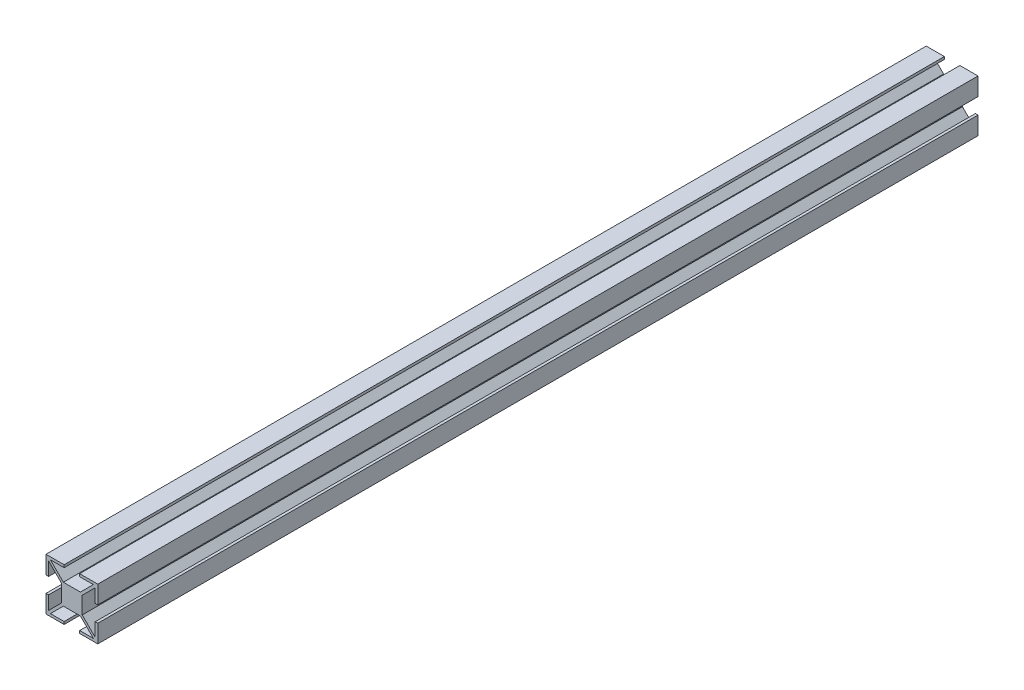
from build123d import *

# Parameters (mm, degrees)
BOSS_EXTRUDE1_DEPTH = 340


with BuildPart() as part:
    # Sketch2 → Boss-Extrude1 (new body)
    with BuildSketch(Plane.XY):
        Polygon((-10, 10), (-3, 10), (-3, 9), (-8.292893219, 9), (-3.292893219, 4), (3.292893219, 4), (8.292893219, 9), (3, 9), (3, 10), (10, 10), (10, 3.074044586), (9, 3.074044586), (9, 8.292893219), (4, 3.292893219), (4, -3.292893219), (9, -8.292893219), (9, -3.074044586), (10, -3.074044586), (10, -10), (3, -10), (3, -9), (8.292893219, -9), (3.292893219, -4), (-3.292893219, -4), (-8.292893219, -9), (-3, -9), (-3, -10), (-10, -10), (-10, -3.074044586), (-9, -3.074044586), (-9, -8.292893219), (-4, -3.292893219), (-4, 3.292893219), (-9, 8.292893219), (-9, 3.074044586), (-10, 3.074044586), align=None)
    extrude(amount=BOSS_EXTRUDE1_DEPTH)


solid = part.part
